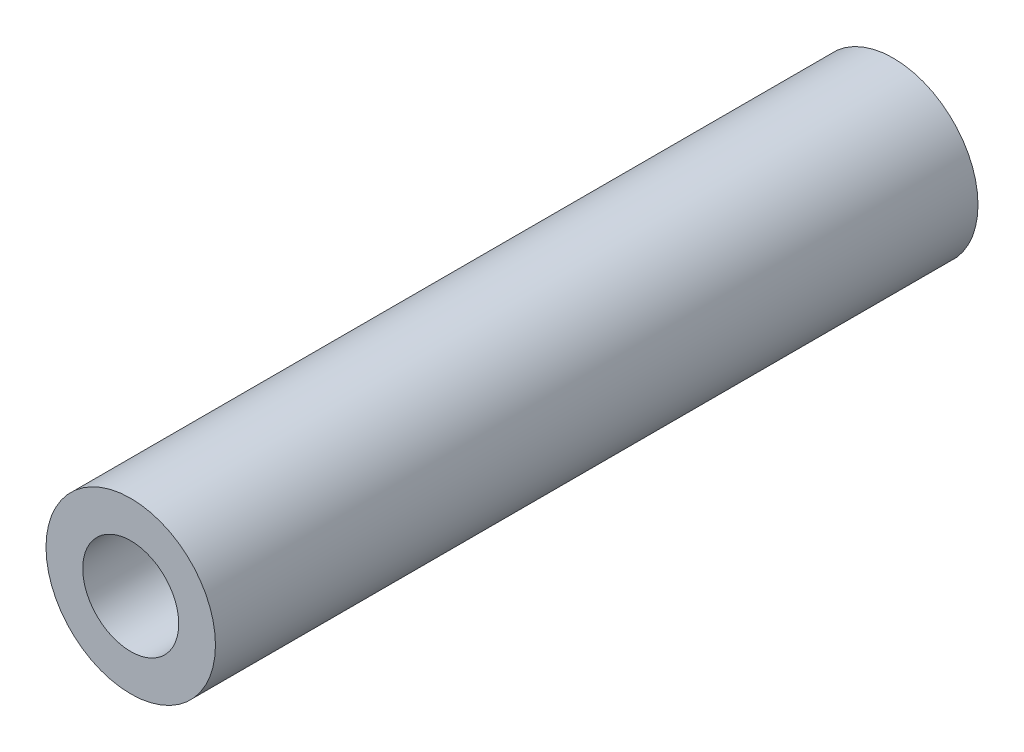
from build123d import *

# Parameters (mm, degrees)
SKETCH1_R           = 3
SKETCH1_R_2         = 1.7
RING_ENVELOPE_DEPTH = 27


with BuildPart() as part:
    # Sketch1 → Ring_Envelope (new body)
    with BuildSketch(Plane.XY):
        Circle(SKETCH1_R)
        Circle(SKETCH1_R_2, mode=Mode.SUBTRACT)
    extrude(amount=RING_ENVELOPE_DEPTH)


solid = part.part
